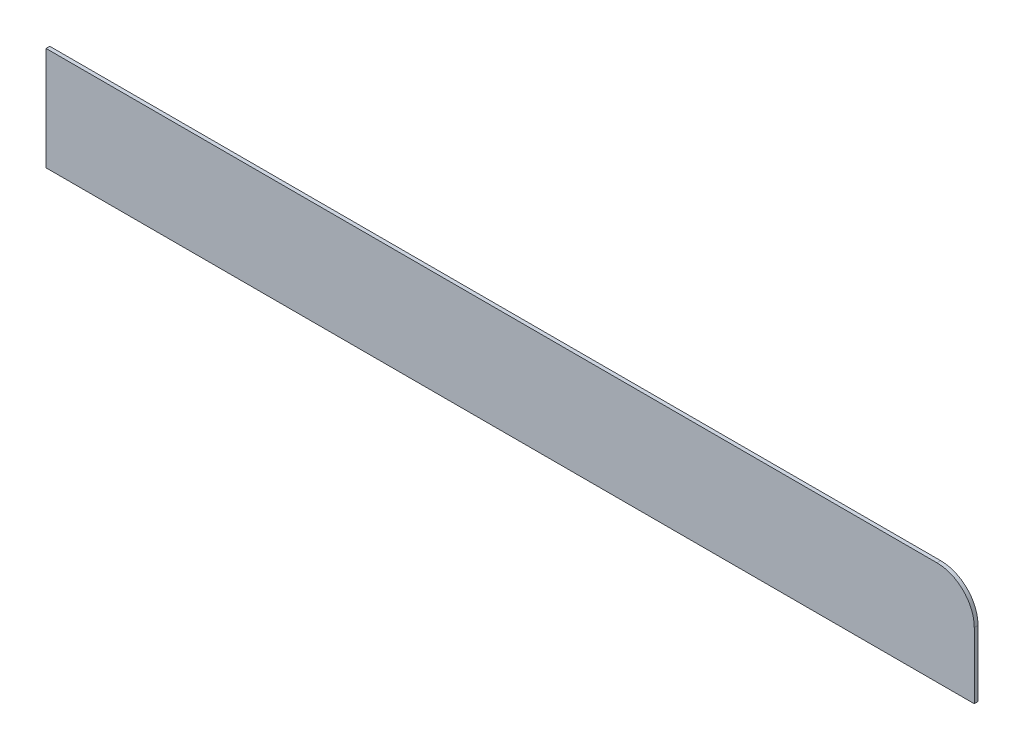
from build123d import *

# Parameters (mm, degrees)
EXTRUDE_1_DEPTH = 3


with BuildPart() as part:
    # Эскиз1 → Бобышка-Вытянуть1 (new body)
    with BuildSketch(Plane.XY):
        with BuildLine():
            Line((-3, 40), (-3, -43))
            Line((-3, -43), (741.992264213, -43))
            Line((741.992264213, -43), (741.992264213, 10))
            ThreePointArc((741.992264213, 10), (733.205467649, 31.213203436), (711.992264213, 40))
            Line((711.992264213, 40), (-3, 40))
        make_face()
    extrude(amount=EXTRUDE_1_DEPTH)


solid = part.part
